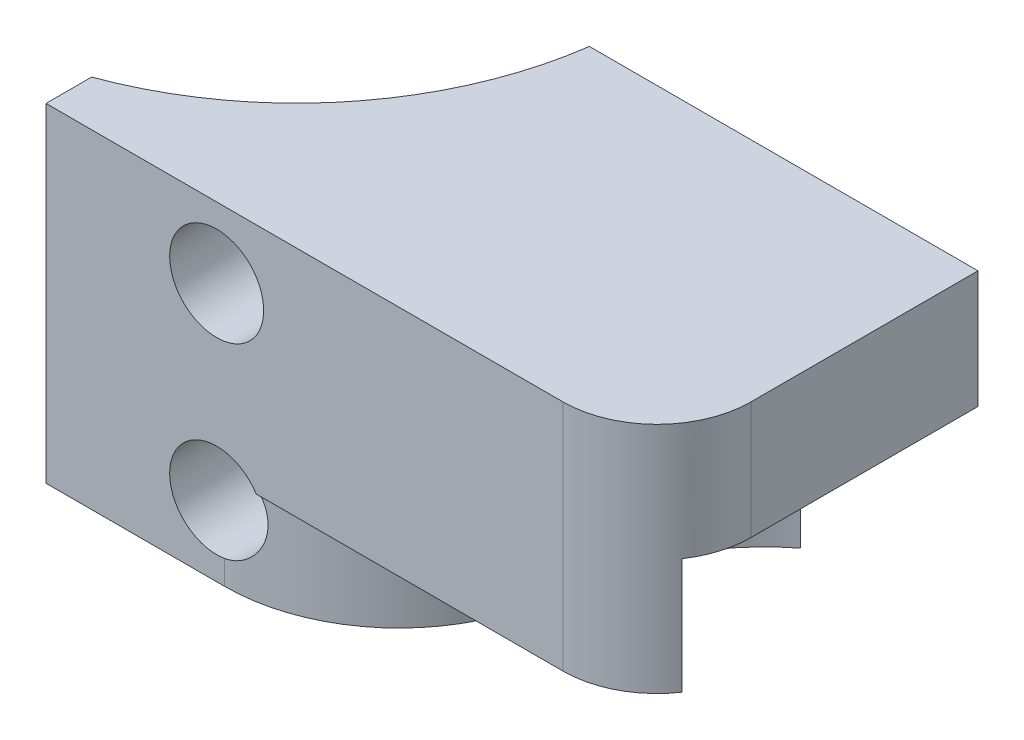
from build123d import *

# Parameters (mm, degrees)
BOSS_EXTRUDE1_DEPTH = 35
SKETCH2_W           = 17.696874766
SKETCH2_H           = 12.5
BOSS_EXTRUDE2_DEPTH = 17.5
BOSS_EXTRUDE3_REACH = 59.1
SKETCH3_W           = 17.576942212
SKETCH3_H           = 12.5
SKETCH6_R           = 5
CUT_EXTRUDE4_DEPTH  = 34.153314003
CUT_EXTRUDE5_START  = -10.195
SKETCH7_R           = 22.5
CUT_EXTRUDE5_DEPTH  = 10.195
CUT_EXTRUDE6_START  = -10.195
CUT_EXTRUDE6_DEPTH  = 10.195
FILLET1_R           = 10


with BuildPart() as part:
    # Sketch1 → Boss-Extrude1 (new body)
    with BuildSketch(Plane(origin=(0, 0, 0), x_dir=(1, 0, 0), z_dir=(0, 1, 0))):
        with BuildLine():
            Line((-23.500000002, -12.2928564), (-23.500000002, -17.153314003))
            Line((-23.500000002, -17.153314003), (41.499999998, -17.153314003))
            Line((41.499999998, -17.153314003), (41.499999998, -12.153314003))
            ThreePointArc((41.499999998, -12.153314003), (29.653468029, -11.155125098), (23.999999998, -0.696874766))
            Line((23.999999998, -0.696874766), (23.999999998, 17))
            Line((23.999999998, 17), (0.15591238, 17))
            ThreePointArc((0.15591238, 17), (-7.603392609, -0.932132231), (-23.500000002, -12.2928564))
        make_face()
    extrude(amount=BOSS_EXTRUDE1_DEPTH)

    # Sketch2 → Boss-Extrude2 (add)
    with BuildSketch(Plane(origin=(23.999999998, 0, 0), x_dir=(0, 0, -1), z_dir=(1, 0, 0))):
        with Locations((8.151562617, 28.75)):
            Rectangle(SKETCH2_W, SKETCH2_H)
    extrude(amount=BOSS_EXTRUDE2_DEPTH)

    # Sketch3 → Boss-Extrude3 (add, up to next)
    with BuildSketch(Plane.XY.offset(0.696874766), mode=Mode.PRIVATE) as boss_extrude3_sk1:
        with Locations((32.711528892, 28.75)):
            Rectangle(SKETCH3_W, SKETCH3_H)
    boss_extrude3_tool1 = extrude(boss_extrude3_sk1.sketch, amount=BOSS_EXTRUDE3_REACH, mode=Mode.PRIVATE) - part.part
    add(boss_extrude3_tool1.solids().sort_by_distance((32.711529, 28.75, 0.696875))[0])

    # Sketch6 → Cut-Extrude4 (cut)
    with BuildSketch(Plane(origin=(0, 0, -17), x_dir=(-1, 0, 0), z_dir=(0, 0, -1))):
        with Locations((5.34408762, 7.5)):
            Circle(SKETCH6_R)
        with Locations((5.34408762, 27.5)):
            Circle(SKETCH6_R)
    extrude(amount=-CUT_EXTRUDE4_DEPTH, mode=Mode.SUBTRACT)

    # Sketch7 → Cut-Extrude5 (cut)
    with BuildSketch(Plane.XZ.offset(CUT_EXTRUDE5_START)):
        with Locations((36.499999998, 0.696874766)):
            Circle(SKETCH7_R)
    extrude(amount=CUT_EXTRUDE5_DEPTH, mode=Mode.SUBTRACT)

    # Sketch8 → Cut-Extrude6 (cut)
    with BuildSketch(Plane.XZ.offset(CUT_EXTRUDE6_START)):
        with BuildLine():
            Line((-4.500000002, 17.153314003), (41.499999998, 17.153314003))
            Line((41.499999998, 17.153314003), (41.499999998, -17))
            Line((41.499999998, -17), (22.605014445, -17))
            Line((22.605014445, -17), (14.020220559, -0.256810916))
            ThreePointArc((14.020220559, -0.256810916), (8.209356978, 12.117427379), (-4.500000002, 17.153314003))
        make_face()
    extrude(amount=CUT_EXTRUDE6_DEPTH, mode=Mode.SUBTRACT)

    # Fillet1
    fillet1_edges = [part.edges().sort_by_distance(p)[0] for p in [
        (41.499999998, 22.5975, 17.153314003),
    ]]
    fillet(fillet1_edges, radius=FILLET1_R)


solid = part.part
